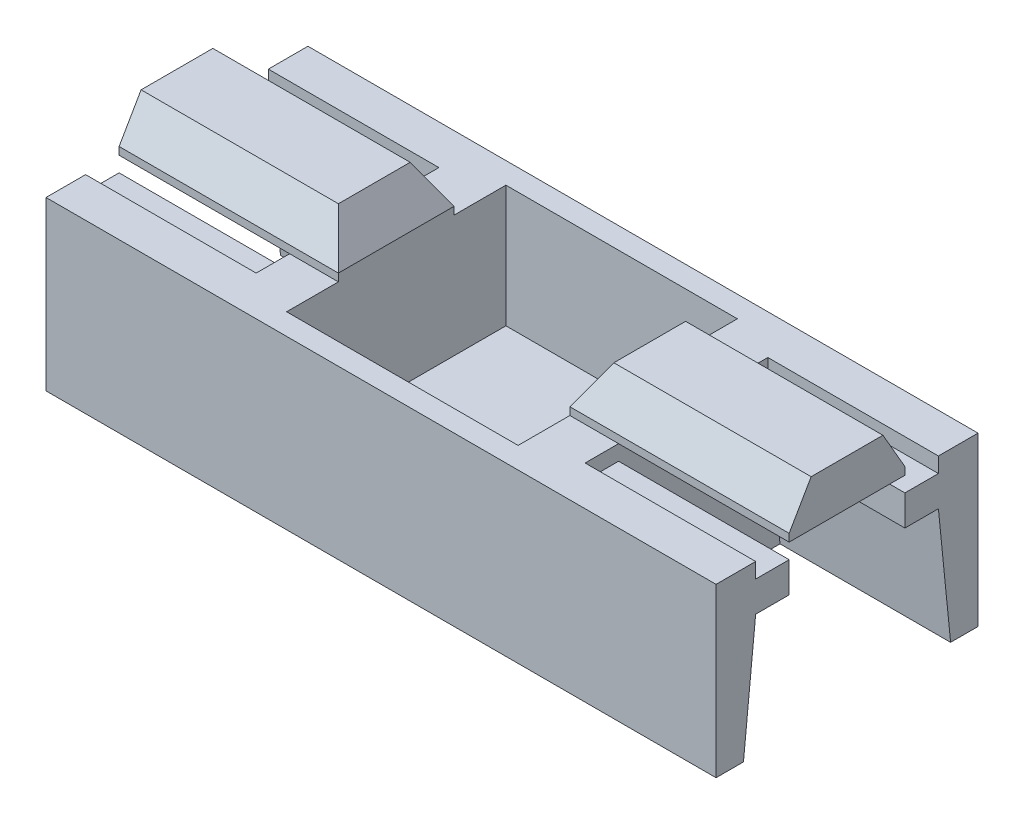
from build123d import *
from OCP.BRepFilletAPI import BRepFilletAPI_MakeChamfer

# Parameters (mm, degrees)
ESQUISSE1_W             = 22
ESQUISSE1_H             = 7
BOSS_EXTRU_1_DEPTH      = 8.6
ESQUISSE2_W             = 7.6
ESQUISSE2_H             = 7.2
ENL_V_MAT_EXTRU_1_DEPTH = 5.5
ESQUISSE3_W             = 2.4
ESQUISSE3_H             = 1.5
ENL_V_MAT_EXTRU_2_DEPTH = 25.636558201
ENL_V_MAT_EXTRU_5_DEPTH = 5.6
CHANFREIN1_SIZE         = 1.25
CHANFREIN1_SIZE2        = 0.721687836
CHANFREIN2_SIZE         = 1.25
CHANFREIN2_SIZE2        = 0.721687836


with BuildPart() as part:
    # Esquisse1 → Boss.-Extru.1 (new body)
    with BuildSketch(Plane.XY):
        with Locations((11, 3.5)):
            Rectangle(ESQUISSE1_W, ESQUISSE1_H)
    extrude(amount=BOSS_EXTRU_1_DEPTH)

    # Esquisse2 → Enlèv. mat.-Extru.1 (cut)
    with BuildSketch(Plane(origin=(0, 7, 0), x_dir=(1, 0, 0), z_dir=(0, 1, 0))):
        with Locations((11, -4.3)):
            Rectangle(ESQUISSE2_W, ESQUISSE2_H)
    extrude(amount=-ENL_V_MAT_EXTRU_1_DEPTH, mode=Mode.SUBTRACT)

    # Esquisse3 → Enlèv. mat.-Extru.2 (cut, through all)
    with BuildSketch(Plane(origin=(22, 0, 0), x_dir=(0, 0, -1), z_dir=(1, 0, 0))):
        with Locations((-1.2, 6.25)):
            Rectangle(ESQUISSE3_W, ESQUISSE3_H)
        with Locations((-7.4, 6.25)):
            Rectangle(ESQUISSE3_W, ESQUISSE3_H)
    extrude(amount=-ENL_V_MAT_EXTRU_2_DEPTH, mode=Mode.SUBTRACT)

    # Esquisse6 → Enlèv. mat.-Extru.5 (cut)
    with BuildSketch(Plane(origin=(22, 0, 0), x_dir=(0, 0, -1), z_dir=(1, 0, 0))):
        Polygon((-1.3, 5.5), (-7.3, 5.5), (-7.3, 5), (-6.2, 5), (-6.2, 4), (-7.3, 4), (-7.7, 0), (-0.9, 0), (-1.3, 4), (-2.4, 4), (-2.4, 5), (-1.3, 5), align=None)
    enl_v_mat_extru_5 = extrude(amount=-ENL_V_MAT_EXTRU_5_DEPTH, mode=Mode.SUBTRACT)

    # Chanfrein1: one chamfer whose edges measure the first distance from different faces: ONE call of the kernel's chamfer builder (chamfer() names one face for all edges)
    chanfrein1_edges_1 = [part.edges().sort_by_distance(p)[0] for p in [
        (14.8, 7, 4.3),
    ]]
    chanfrein1_side_1 = [part.faces().sort_by_distance(p)[0] for p in [
        (14.8, 3.954347826, 4.3),
    ]]
    chanfrein1_edges_2 = [part.edges().sort_by_distance(p)[0] for p in [
        (18.4, 7, 6.2),
    ]]
    chanfrein1_side_2 = [part.faces().sort_by_distance(p)[0] for p in [
        (18.4, 6.25, 6.2),
    ]]
    chanfrein1_edges_3 = [part.edges().sort_by_distance(p)[0] for p in [
        (18.4, 7, 2.4),
    ]]
    chanfrein1_side_3 = [part.faces().sort_by_distance(p)[0] for p in [
        (18.4, 6.25, 2.4),
    ]]
    chanfrein1 = BRepFilletAPI_MakeChamfer(part.part.solid().wrapped)
    for e in chanfrein1_edges_1:
        chanfrein1.Add(CHANFREIN1_SIZE, CHANFREIN1_SIZE2, e.wrapped, chanfrein1_side_1[0].wrapped)  # the first distance lies on this face
    for e in chanfrein1_edges_2:
        chanfrein1.Add(CHANFREIN1_SIZE, CHANFREIN1_SIZE2, e.wrapped, chanfrein1_side_2[0].wrapped)  # the first distance lies on this face
    for e in chanfrein1_edges_3:
        chanfrein1.Add(CHANFREIN1_SIZE, CHANFREIN1_SIZE2, e.wrapped, chanfrein1_side_3[0].wrapped)  # the first distance lies on this face
    add(Compound.cast(chanfrein1.Shape()), mode=Mode.REPLACE)

    # Symétrie4: Enlèv. mat.-Extru.5 across plane
    add(enl_v_mat_extru_5.mirror(Plane(origin=(11, 0, 0), x_dir=(0, 0, 1), z_dir=(1, 0, 0))), mode=Mode.SUBTRACT)

    # Chanfrein2: one chamfer whose edges measure the first distance from different faces: ONE call of the kernel's chamfer builder (chamfer() names one face for all edges)
    chanfrein2_edges_1 = [part.edges().sort_by_distance(p)[0] for p in [
        (3.6, 7, 6.2),
    ]]
    chanfrein2_side_1 = [part.faces().sort_by_distance(p)[0] for p in [
        (3.6, 6.25, 6.2),
    ]]
    chanfrein2_edges_2 = [part.edges().sort_by_distance(p)[0] for p in [
        (7.2, 7, 4.3),
    ]]
    chanfrein2_side_2 = [part.faces().sort_by_distance(p)[0] for p in [
        (7.2, 3.954347826, 4.3),
    ]]
    chanfrein2_edges_3 = [part.edges().sort_by_distance(p)[0] for p in [
        (3.6, 7, 2.4),
    ]]
    chanfrein2_side_3 = [part.faces().sort_by_distance(p)[0] for p in [
        (3.6, 6.25, 2.4),
    ]]
    chanfrein2 = BRepFilletAPI_MakeChamfer(part.part.solid().wrapped)
    for e in chanfrein2_edges_1:
        chanfrein2.Add(CHANFREIN2_SIZE, CHANFREIN2_SIZE2, e.wrapped, chanfrein2_side_1[0].wrapped)  # the first distance lies on this face
    for e in chanfrein2_edges_2:
        chanfrein2.Add(CHANFREIN2_SIZE, CHANFREIN2_SIZE2, e.wrapped, chanfrein2_side_2[0].wrapped)  # the first distance lies on this face
    for e in chanfrein2_edges_3:
        chanfrein2.Add(CHANFREIN2_SIZE, CHANFREIN2_SIZE2, e.wrapped, chanfrein2_side_3[0].wrapped)  # the first distance lies on this face
    add(Compound.cast(chanfrein2.Shape()), mode=Mode.REPLACE)


solid = part.part
